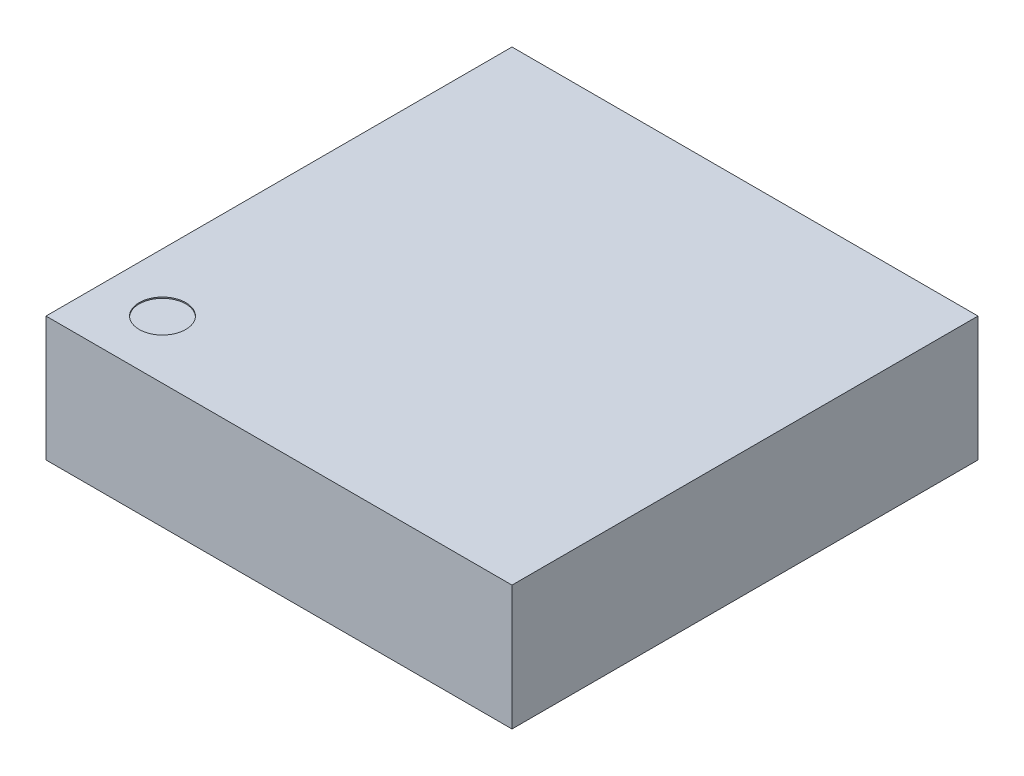
from build123d import *

# Parameters (mm, degrees)
SKETCH1_W              = 0.35
SKETCH1_H              = 0.2
BOSS_EXTRUDE1_DEPTH    = 0.2
BOSS_EXTRUDE1_2_DEPTH  = 0.2
BOSS_EXTRUDE1_3_DEPTH  = 0.2
SKETCH1_W_2            = 0.2
SKETCH1_H_2            = 0.35
BOSS_EXTRUDE1_4_DEPTH  = 0.2
BOSS_EXTRUDE1_5_DEPTH  = 0.2
BOSS_EXTRUDE1_6_DEPTH  = 0.2
BOSS_EXTRUDE1_7_DEPTH  = 0.2
BOSS_EXTRUDE1_8_DEPTH  = 0.2
BOSS_EXTRUDE1_9_DEPTH  = 0.2
BOSS_EXTRUDE1_10_DEPTH = 0.2
BOSS_EXTRUDE1_11_DEPTH = 0.2
BOSS_EXTRUDE1_12_DEPTH = 0.2
BOSS_EXTRUDE1_13_DEPTH = 0.2
BOSS_EXTRUDE1_14_DEPTH = 0.2
BOSS_EXTRUDE1_15_DEPTH = 0.2
BOSS_EXTRUDE1_16_DEPTH = 0.2
BOSS_EXTRUDE1_17_DEPTH = 0.2
BOSS_EXTRUDE1_18_DEPTH = 0.2
BOSS_EXTRUDE1_19_DEPTH = 0.2
BOSS_EXTRUDE1_20_DEPTH = 0.2
BOSS_EXTRUDE1_21_DEPTH = 0.2
BOSS_EXTRUDE1_22_DEPTH = 0.2
BOSS_EXTRUDE1_23_DEPTH = 0.2
BOSS_EXTRUDE1_24_DEPTH = 0.2
BOSS_EXTRUDE2_START    = 0.01
SKETCH2_W              = 4
SKETCH2_H              = 4
BOSS_EXTRUDE2_DEPTH    = 1.07
SKETCH3_R              = 0.2
CUT_EXTRUDE2_DEPTH     = 0.01


with BuildPart() as part:
    # Sketch1 → Boss-Extrude1 (new body)
    with BuildSketch(Plane(origin=(0, 0, 0), x_dir=(1, 0, 0), z_dir=(0, 1, 0))):
        with Locations((-1.75, 0.75)):
            Rectangle(SKETCH1_W, SKETCH1_H)
    extrude(amount=BOSS_EXTRUDE1_DEPTH)


with BuildPart() as body_2:
    # Sketch1 → Boss-Extrude1 2 (new body)
    with BuildSketch(Plane(origin=(0, 0, 0), x_dir=(1, 0, 0), z_dir=(0, 1, 0))):
        with Locations((-1.75, 1.25)):
            Rectangle(SKETCH1_W, SKETCH1_H)
    extrude(amount=BOSS_EXTRUDE1_2_DEPTH)


with BuildPart() as body_3:
    # Sketch1 → Boss-Extrude1 3 (new body)
    with BuildSketch(Plane(origin=(0, 0, 0), x_dir=(1, 0, 0), z_dir=(0, 1, 0))):
        with Locations((-1.75, 0.25)):
            Rectangle(SKETCH1_W, SKETCH1_H)
    extrude(amount=BOSS_EXTRUDE1_3_DEPTH)


with BuildPart() as body_4:
    # Sketch1 → Boss-Extrude1 4 (new body)
    with BuildSketch(Plane(origin=(0, 0, 0), x_dir=(1, 0, 0), z_dir=(0, 1, 0))):
        with Locations((-0.75, 1.75)):
            Rectangle(SKETCH1_W_2, SKETCH1_H_2)
    extrude(amount=BOSS_EXTRUDE1_4_DEPTH)


with BuildPart() as body_5:
    # Sketch1 → Boss-Extrude1 5 (new body)
    with BuildSketch(Plane(origin=(0, 0, 0), x_dir=(1, 0, 0), z_dir=(0, 1, 0))):
        with Locations((-1.25, 1.75)):
            Rectangle(SKETCH1_W_2, SKETCH1_H_2)
    extrude(amount=BOSS_EXTRUDE1_5_DEPTH)


with BuildPart() as body_6:
    # Sketch1 → Boss-Extrude1 6 (new body)
    with BuildSketch(Plane(origin=(0, 0, 0), x_dir=(1, 0, 0), z_dir=(0, 1, 0))):
        with Locations((-0.25, 1.75)):
            Rectangle(SKETCH1_W_2, SKETCH1_H_2)
    extrude(amount=BOSS_EXTRUDE1_6_DEPTH)


with BuildPart() as body_7:
    # Sketch1 → Boss-Extrude1 7 (new body)
    with BuildSketch(Plane(origin=(0, 0, 0), x_dir=(1, 0, 0), z_dir=(0, 1, 0))):
        with Locations((0.25, 1.75)):
            Rectangle(SKETCH1_W_2, SKETCH1_H_2)
    extrude(amount=BOSS_EXTRUDE1_7_DEPTH)


with BuildPart() as body_8:
    # Sketch1 → Boss-Extrude1 8 (new body)
    with BuildSketch(Plane(origin=(0, 0, 0), x_dir=(1, 0, 0), z_dir=(0, 1, 0))):
        with Locations((0.75, 1.75)):
            Rectangle(SKETCH1_W_2, SKETCH1_H_2)
    extrude(amount=BOSS_EXTRUDE1_8_DEPTH)


with BuildPart() as body_9:
    # Sketch1 → Boss-Extrude1 9 (new body)
    with BuildSketch(Plane(origin=(0, 0, 0), x_dir=(1, 0, 0), z_dir=(0, 1, 0))):
        with Locations((1.25, 1.75)):
            Rectangle(SKETCH1_W_2, SKETCH1_H_2)
    extrude(amount=BOSS_EXTRUDE1_9_DEPTH)


with BuildPart() as body_10:
    # Sketch1 → Boss-Extrude1 10 (new body)
    with BuildSketch(Plane(origin=(0, 0, 0), x_dir=(1, 0, 0), z_dir=(0, 1, 0))):
        with Locations((1.75, 0.25)):
            Rectangle(SKETCH1_W, SKETCH1_H)
    extrude(amount=BOSS_EXTRUDE1_10_DEPTH)


with BuildPart() as body_11:
    # Sketch1 → Boss-Extrude1 11 (new body)
    with BuildSketch(Plane(origin=(0, 0, 0), x_dir=(1, 0, 0), z_dir=(0, 1, 0))):
        with Locations((1.75, 0.75)):
            Rectangle(SKETCH1_W, SKETCH1_H)
    extrude(amount=BOSS_EXTRUDE1_11_DEPTH)


with BuildPart() as body_12:
    # Sketch1 → Boss-Extrude1 12 (new body)
    with BuildSketch(Plane(origin=(0, 0, 0), x_dir=(1, 0, 0), z_dir=(0, 1, 0))):
        with Locations((1.75, 1.25)):
            Rectangle(SKETCH1_W, SKETCH1_H)
    extrude(amount=BOSS_EXTRUDE1_12_DEPTH)


with BuildPart() as body_13:
    # Sketch1 → Boss-Extrude1 13 (new body)
    with BuildSketch(Plane(origin=(0, 0, 0), x_dir=(1, 0, 0), z_dir=(0, 1, 0))):
        with Locations((1.75, -0.75)):
            Rectangle(SKETCH1_W, SKETCH1_H)
    extrude(amount=BOSS_EXTRUDE1_13_DEPTH)


with BuildPart() as body_14:
    # Sketch1 → Boss-Extrude1 14 (new body)
    with BuildSketch(Plane(origin=(0, 0, 0), x_dir=(1, 0, 0), z_dir=(0, 1, 0))):
        with Locations((1.75, -1.25)):
            Rectangle(SKETCH1_W, SKETCH1_H)
    extrude(amount=BOSS_EXTRUDE1_14_DEPTH)


with BuildPart() as body_15:
    # Sketch1 → Boss-Extrude1 15 (new body)
    with BuildSketch(Plane(origin=(0, 0, 0), x_dir=(1, 0, 0), z_dir=(0, 1, 0))):
        with Locations((1.75, -0.25)):
            Rectangle(SKETCH1_W, SKETCH1_H)
    extrude(amount=BOSS_EXTRUDE1_15_DEPTH)


with BuildPart() as body_16:
    # Sketch1 → Boss-Extrude1 16 (new body)
    with BuildSketch(Plane(origin=(0, 0, 0), x_dir=(1, 0, 0), z_dir=(0, 1, 0))):
        with Locations((0.75, -1.75)):
            Rectangle(SKETCH1_W_2, SKETCH1_H_2)
    extrude(amount=BOSS_EXTRUDE1_16_DEPTH)


with BuildPart() as body_17:
    # Sketch1 → Boss-Extrude1 17 (new body)
    with BuildSketch(Plane(origin=(0, 0, 0), x_dir=(1, 0, 0), z_dir=(0, 1, 0))):
        with Locations((1.25, -1.75)):
            Rectangle(SKETCH1_W_2, SKETCH1_H_2)
    extrude(amount=BOSS_EXTRUDE1_17_DEPTH)


with BuildPart() as body_18:
    # Sketch1 → Boss-Extrude1 18 (new body)
    with BuildSketch(Plane(origin=(0, 0, 0), x_dir=(1, 0, 0), z_dir=(0, 1, 0))):
        with Locations((0.25, -1.75)):
            Rectangle(SKETCH1_W_2, SKETCH1_H_2)
    extrude(amount=BOSS_EXTRUDE1_18_DEPTH)


with BuildPart() as body_19:
    # Sketch1 → Boss-Extrude1 19 (new body)
    with BuildSketch(Plane(origin=(0, 0, 0), x_dir=(1, 0, 0), z_dir=(0, 1, 0))):
        with Locations((-0.25, -1.75)):
            Rectangle(SKETCH1_W_2, SKETCH1_H_2)
    extrude(amount=BOSS_EXTRUDE1_19_DEPTH)


with BuildPart() as body_20:
    # Sketch1 → Boss-Extrude1 20 (new body)
    with BuildSketch(Plane(origin=(0, 0, 0), x_dir=(1, 0, 0), z_dir=(0, 1, 0))):
        with Locations((-0.75, -1.75)):
            Rectangle(SKETCH1_W_2, SKETCH1_H_2)
    extrude(amount=BOSS_EXTRUDE1_20_DEPTH)


with BuildPart() as body_21:
    # Sketch1 → Boss-Extrude1 21 (new body)
    with BuildSketch(Plane(origin=(0, 0, 0), x_dir=(1, 0, 0), z_dir=(0, 1, 0))):
        with Locations((-1.25, -1.75)):
            Rectangle(SKETCH1_W_2, SKETCH1_H_2)
    extrude(amount=BOSS_EXTRUDE1_21_DEPTH)


with BuildPart() as body_22:
    # Sketch1 → Boss-Extrude1 22 (new body)
    with BuildSketch(Plane(origin=(0, 0, 0), x_dir=(1, 0, 0), z_dir=(0, 1, 0))):
        with Locations((-1.75, -0.25)):
            Rectangle(SKETCH1_W, SKETCH1_H)
    extrude(amount=BOSS_EXTRUDE1_22_DEPTH)


with BuildPart() as body_23:
    # Sketch1 → Boss-Extrude1 23 (new body)
    with BuildSketch(Plane(origin=(0, 0, 0), x_dir=(1, 0, 0), z_dir=(0, 1, 0))):
        with Locations((-1.75, -0.75)):
            Rectangle(SKETCH1_W, SKETCH1_H)
    extrude(amount=BOSS_EXTRUDE1_23_DEPTH)


with BuildPart() as body_24:
    # Sketch1 → Boss-Extrude1 24 (new body)
    with BuildSketch(Plane(origin=(0, 0, 0), x_dir=(1, 0, 0), z_dir=(0, 1, 0))):
        with Locations((-1.75, -1.25)):
            Rectangle(SKETCH1_W, SKETCH1_H)
    extrude(amount=BOSS_EXTRUDE1_24_DEPTH)


with BuildPart() as body_25:
    # Sketch2 → Boss-Extrude2 (new body)
    with BuildSketch(Plane(origin=(0, 0, 0), x_dir=(1, 0, 0), z_dir=(0, 1, 0)).offset(BOSS_EXTRUDE2_START)):
        Rectangle(SKETCH2_W, SKETCH2_H)
    extrude(amount=BOSS_EXTRUDE2_DEPTH)

    # Sketch3 → Cut-Extrude2 (cut)
    with BuildSketch(Plane(origin=(0, 1.08, 0), x_dir=(1, 0, 0), z_dir=(0, 1, 0))):
        with Locations(Location((-1.5, -1.5, 0), (0, 0, 270))):
            Circle(SKETCH3_R)
    extrude(amount=-CUT_EXTRUDE2_DEPTH, mode=Mode.SUBTRACT)


solid = Compound([part.part, body_2.part, body_3.part, body_4.part, body_5.part, body_6.part, body_7.part, body_8.part, body_9.part, body_10.part, body_11.part, body_12.part, body_13.part, body_14.part, body_15.part, body_16.part, body_17.part, body_18.part, body_19.part, body_20.part, body_21.part, body_22.part, body_23.part, body_24.part, body_25.part])
